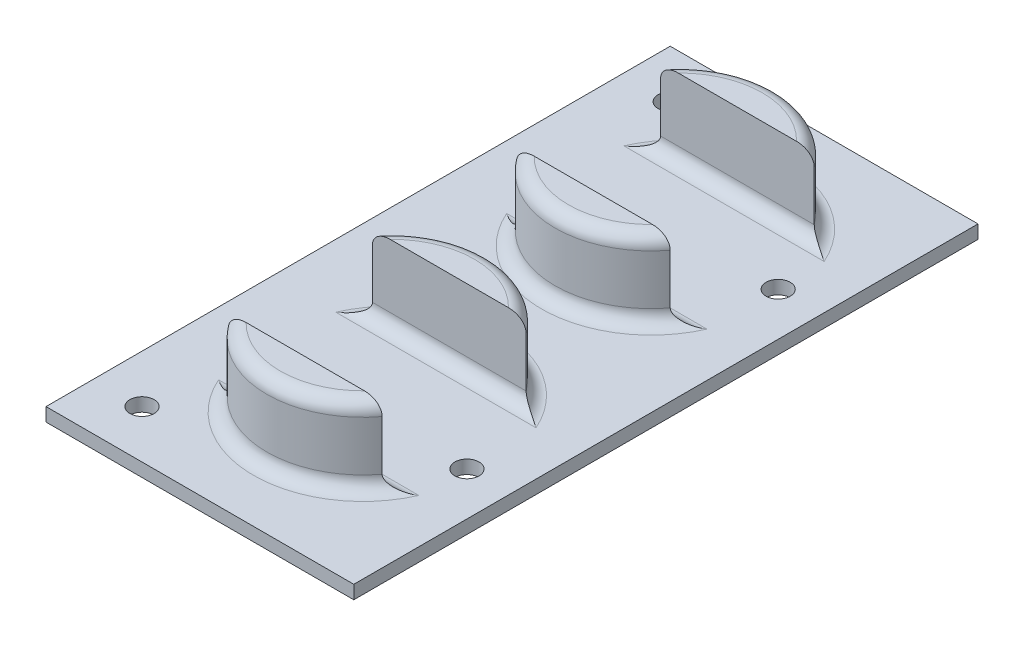
from build123d import *

# Parameters (mm, degrees)
SKETCH1_W            = 30.48
SKETCH1_H            = 31.75
BOSS_EXTRUDE1_DEPTH  = 1.778
BOSS_EXTRUDE2_DEPTH  = 10.16
SKETCH4_W            = 127
SKETCH4_H            = 82.55
SKETCH4_W_2          = 30.48
SKETCH4_H_2          = 31.75
BOSS_EXTRUDE3_DEPTH  = 1.778
LPATTERN1_COUNT      = 2
LPATTERN1_PITCH      = 83.82
LPATTERN1_COUNT_DIR2 = 2
LPATTERN1_PITCH_DIR2 = 38.1
BOSS_EXTRUDE4_DEPTH  = 10.16
FILLET2_R            = 1.778
FILLET3_R            = 1.778
SKETCH6_R            = 1.6
CUT_EXTRUDE1_DEPTH   = 129.978488912
SKETCH7_R            = 1.6
CUT_EXTRUDE2_DEPTH   = 129.978488912
SKETCH8_W            = 86.294069194
SKETCH8_H            = 82.55
CUT_EXTRUDE3_DEPTH   = 130.130712251


with BuildPart() as part:
    # Sketch1 → Boss-Extrude1 (new body)
    with BuildSketch(Plane(origin=(0, 0, 0), x_dir=(1, 0, 0), z_dir=(0, 1, 0))):
        with Locations((15.24, 15.875)):
            Rectangle(SKETCH1_W, SKETCH1_H)
    extrude(amount=BOSS_EXTRUDE1_DEPTH)

    # Sketch2 → Boss-Extrude2 (add)
    with BuildSketch(Plane(origin=(0, 1.778, 0), x_dir=(1, 0, 0), z_dir=(0, 1, 0))):
        with BuildLine():
            ThreePointArc((25.4, 25.4), (15.24, 30.48), (5.08, 25.4))
            Line((5.08, 25.4), (25.4, 25.4))
        make_face()
        with BuildLine():
            Line((25.4, 6.35), (5.08, 6.35))
            ThreePointArc((5.08, 6.35), (15.24, 1.27), (25.4, 6.35))
        make_face()
    boss_extrude2 = extrude(amount=BOSS_EXTRUDE2_DEPTH)

    # Sketch4 → Boss-Extrude3 (add)
    with BuildSketch(Plane(origin=(0, 1.778, 0), x_dir=(1, 0, 0), z_dir=(0, 1, 0))):
        with Locations((57.15, -3.175)):
            Rectangle(SKETCH4_W, SKETCH4_H)
        with Locations((15.24, 15.875)):
            Rectangle(SKETCH4_W_2, SKETCH4_H_2, mode=Mode.SUBTRACT)
    extrude(amount=-BOSS_EXTRUDE3_DEPTH)

    # LPattern1: Boss-Extrude2 2 × 2
    with Locations(*[(i * LPATTERN1_PITCH, 0, j * LPATTERN1_PITCH_DIR2) for i in range(LPATTERN1_COUNT) for j in range(LPATTERN1_COUNT_DIR2) if (i, j) != (0, 0)]):
        add(boss_extrude2)

    # Sketch5 → Boss-Extrude4 (add)
    with BuildSketch(Plane(origin=(0, 1.778, 0), x_dir=(1, 0, 0), z_dir=(0, 1, 0))):
        with BuildLine():
            ThreePointArc((47.625, -12.7), (42.545, -22.86), (47.625, -33.02))
            Line((47.625, -33.02), (47.625, -12.7))
        make_face()
        with BuildLine():
            Line((66.675, -12.7), (66.675, -33.02))
            ThreePointArc((66.675, -33.02), (71.755, -22.86), (66.675, -12.7))
        make_face()
    extrude(amount=BOSS_EXTRUDE4_DEPTH)

    # Fillet2
    fillet2_edges = [part.edges().sort_by_distance(p)[0] for p in [
        (15.24, 11.938, -1.27),
        (15.24, 11.938, -30.48),
        (99.06, 11.938, -30.48),
        (99.06, 11.938, -1.27),
        (99.06, 11.938, 7.62),
        (99.06, 11.938, 36.83),
        (42.545, 11.938, 22.86),
        (71.755, 11.938, 22.86),
        (15.24, 11.938, 36.83),
        (15.24, 11.938, 7.62),
    ]]
    fillet(fillet2_edges, radius=FILLET2_R)

    # Fillet3
    fillet3_edges = [part.edges().sort_by_distance(p)[0] for p in [
        (99.06, 1.778, -30.48),
        (99.06, 1.778, -6.35),
        (99.06, 1.778, 7.62),
        (99.06, 1.778, 31.75),
        (99.06, 1.778, -25.4),
        (99.06, 1.778, -1.27),
        (99.06, 1.778, 12.7),
        (99.06, 1.778, 36.83),
        (47.625, 1.778, 22.86),
        (71.755, 1.778, 22.86),
        (15.24, 1.778, 31.75),
        (15.24, 1.778, 36.83),
        (66.675, 1.778, 22.86),
        (42.545, 1.778, 22.86),
        (15.24, 1.778, -6.35),
        (15.24, 1.778, 7.62),
        (15.24, 1.778, 12.7),
        (15.24, 1.778, -1.27),
        (15.24, 1.778, -30.48),
        (15.24, 1.778, -25.4),
    ]]
    fillet(fillet3_edges, radius=FILLET3_R)

    # Sketch6 → Cut-Extrude1 (cut, through all)
    with BuildSketch(Plane(origin=(0, 1.778, 0), x_dir=(1, 0, 0), z_dir=(0, 1, 0))):
        with Locations((85.6742, 17.402175)):
            Circle(SKETCH6_R)
        with Locations((28.6258, 17.402175)):
            Circle(SKETCH6_R)
        with Locations((28.6258, -23.753445)):
            Circle(SKETCH6_R)
        with Locations((85.6742, -23.753445)):
            Circle(SKETCH6_R)
    extrude(amount=-CUT_EXTRUDE1_DEPTH, mode=Mode.SUBTRACT)

    # Sketch7 → Cut-Extrude2 (cut, through all)
    with BuildSketch(Plane(origin=(0, 1.778, 0), x_dir=(1, 0, 0), z_dir=(0, 1, 0))):
        with Locations((0, 31.75)):
            Circle(SKETCH7_R)
        with Locations((114.3, 31.75)):
            Circle(SKETCH7_R)
        with Locations((114.3, -38.1)):
            Circle(SKETCH7_R)
        with Locations((0, -38.1)):
            Circle(SKETCH7_R)
    extrude(amount=-CUT_EXTRUDE2_DEPTH, mode=Mode.SUBTRACT)

    # Sketch8 → Cut-Extrude3 (cut, through all)
    with BuildSketch(Plane.XZ):
        with Locations((77.502965403, 3.175)):
            Rectangle(SKETCH8_W, SKETCH8_H)
    extrude(amount=-CUT_EXTRUDE3_DEPTH, mode=Mode.SUBTRACT)


solid = part.part
